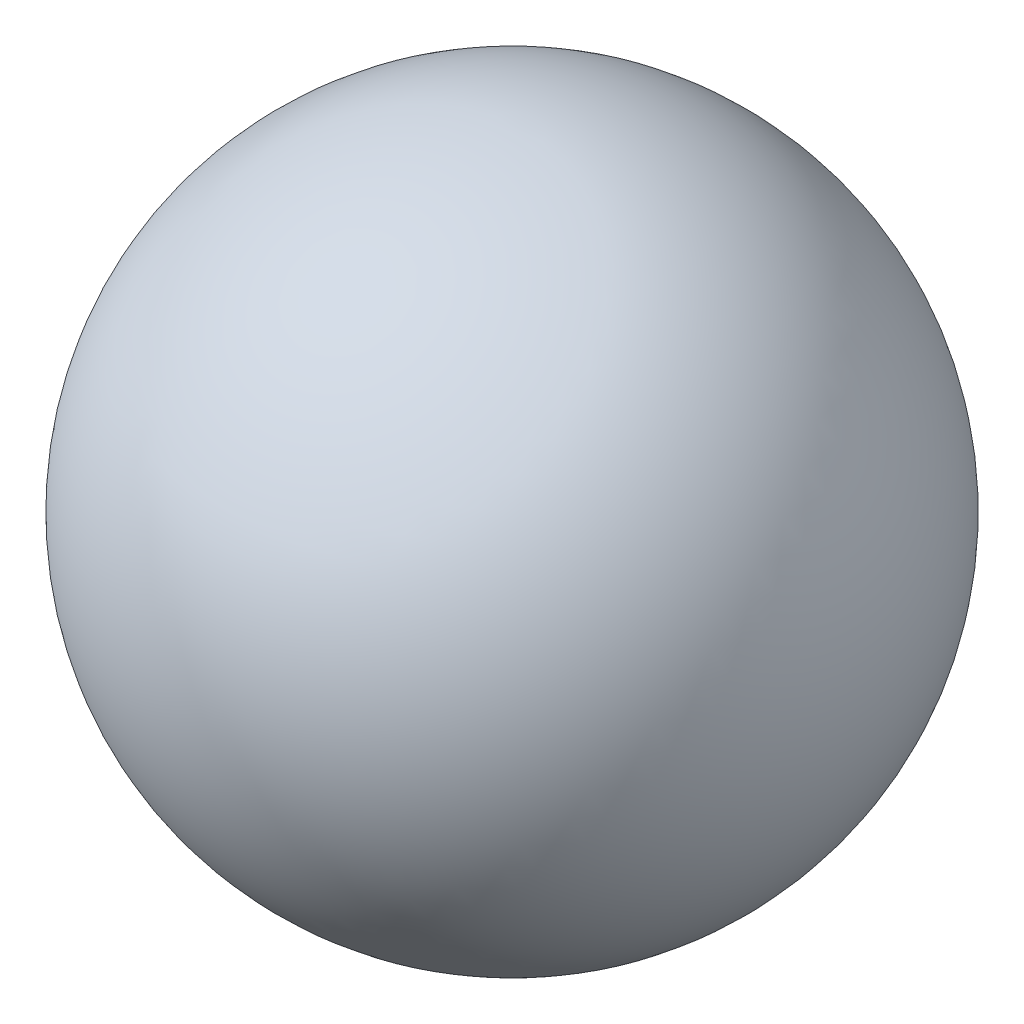
from build123d import *


with BuildPart() as part:
    # Sketch2 → Revolve2 (revolve)
    with BuildSketch(Plane.XY):
        with BuildLine():
            Line((0, 19.687330135), (0, -19.687330135))
            ThreePointArc((0, -19.687330135), (19.687330135, 0), (0, 19.687330135))
        make_face()
    revolve(axis=Axis((0, 19.687330135, 0), (0, -1, 0)))


solid = part.part
